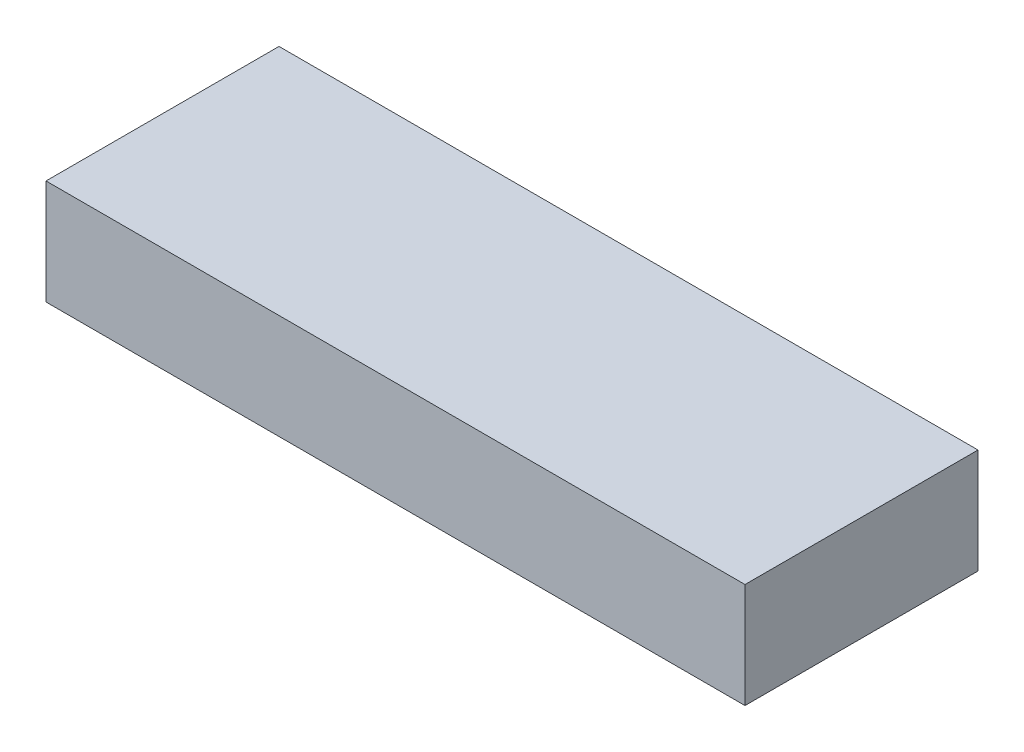
from build123d import *

# Parameters (mm, degrees)
SKETCH2_W           = 15.24
SKETCH2_H           = 5.08
BOSS_EXTRUDE1_DEPTH = 2.286


with BuildPart() as part:
    # Sketch2 → Boss-Extrude1 (new body)
    with BuildSketch(Plane(origin=(0, 0, 0), x_dir=(1, 0, 0), z_dir=(0, 1, 0))):
        with Locations((-7.62, 2.54)):
            Rectangle(SKETCH2_W, SKETCH2_H)
    extrude(amount=BOSS_EXTRUDE1_DEPTH)


solid = part.part
